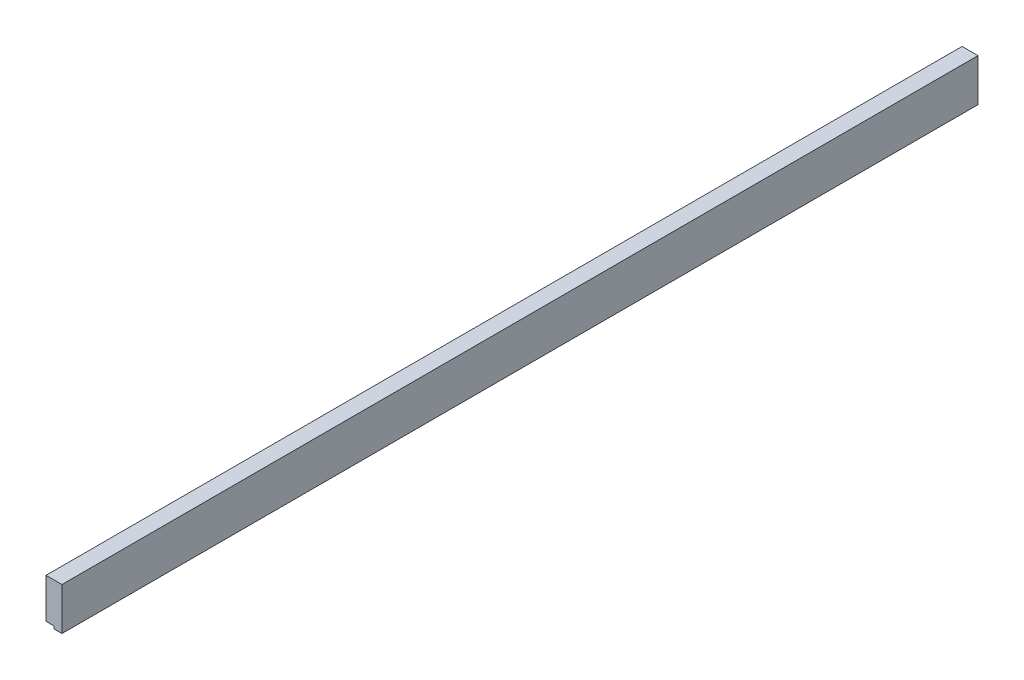
from build123d import *

# Parameters (mm, degrees)
SKETCH1_W           = 2190.75
SKETCH1_H           = 101.6
BOSS_EXTRUDE1_DEPTH = 38.1
SKETCH3_W           = 431.8
SKETCH3_H           = 6.35
SKETCH3_W_2         = 1057.275
SKETCH3_H_2         = 38.1
CUT_EXTRUDE1_DEPTH  = 19.05
SKETCH3_3_W         = 85.725
SKETCH3_3_H         = 25.4
CUT_EXTRUDE2_DEPTH  = 9.525


with BuildPart() as part:
    # Sketch1 → Boss-Extrude1 (new body)
    with BuildSketch(Plane(origin=(0, 0, 0), x_dir=(0, 0, -1), z_dir=(1, 0, 0))):
        Rectangle(SKETCH1_W, SKETCH1_H)
    extrude(amount=BOSS_EXTRUDE1_DEPTH)

    # Sketch3 → Cut-Extrude1 (cut)
    with BuildSketch(Plane.ZY):
        with Locations((879.475, -47.625)):
            Rectangle(SKETCH3_W, SKETCH3_H)
        with Locations((-57.15, -31.75)):
            Rectangle(SKETCH3_W_2, SKETCH3_H_2)
    extrude(amount=-CUT_EXTRUDE1_DEPTH, mode=Mode.SUBTRACT)

    # Sketch3<3> → Cut-Extrude2 (cut)
    with BuildSketch(Plane.ZY):
        with Locations((-652.4625, -38.1)):
            Rectangle(SKETCH3_3_W, SKETCH3_3_H)
        with Locations((538.1625, -38.1)):
            Rectangle(SKETCH3_3_W, SKETCH3_3_H)
    extrude(amount=-CUT_EXTRUDE2_DEPTH, mode=Mode.SUBTRACT)


solid = part.part
